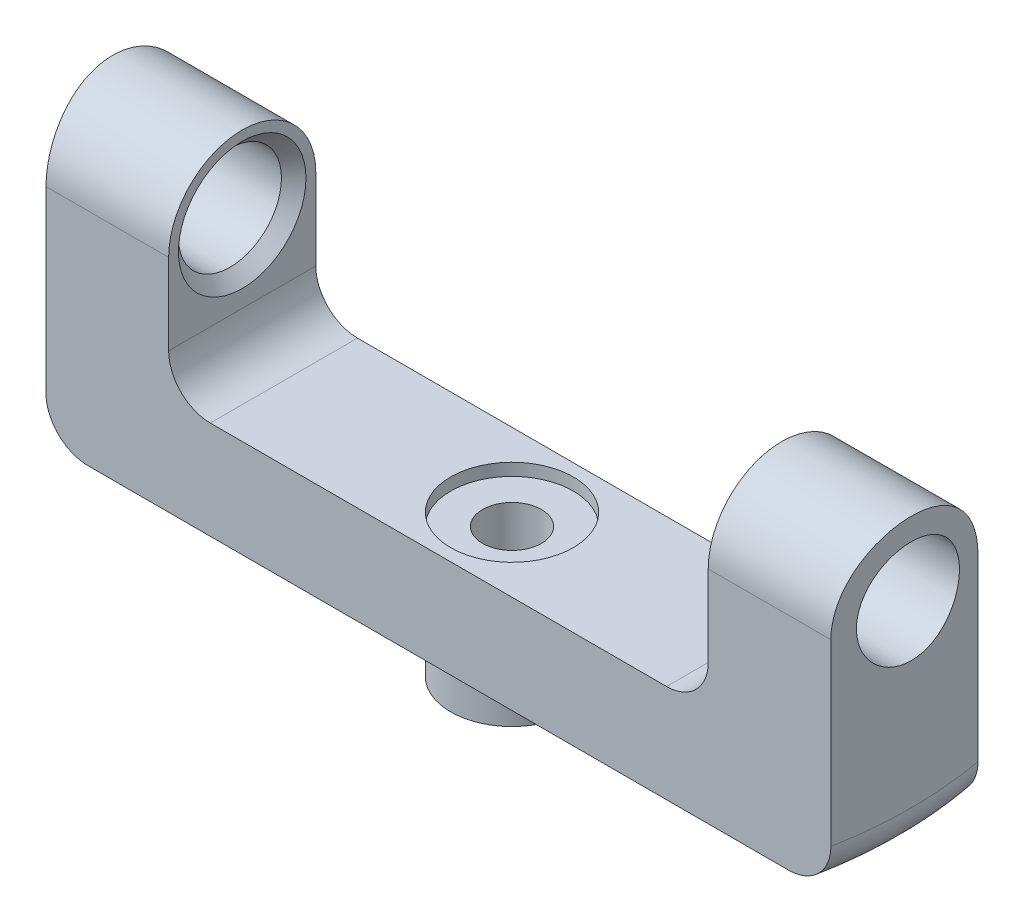
from build123d import *

# Parameters (mm, degrees)
SKETCH1_W               = 5
SKETCH1_H               = 6
SKETCH1_W_2             = 22
BOSS_EXTRUDE1_DEPTH     = 4
BOSS_EXTRUDE2_START     = 4
SKETCH1_3_W             = 5
SKETCH1_3_H             = 6
BOSS_EXTRUDE2_DEPTH     = 8
CUT_EXTRUDE1_DEPTH      = 30.952196132
CUT_EXTRUDE1_DEPTH_BACK = 30.952196132
SKETCH2_R               = 2.1
SKETCH4_R               = 2.5
BOSS_EXTRUDE3_DEPTH     = 1.8
CUT_EXTRUDE2_DEPTH      = 22.550870206
CUT_EXTRUDE2_DEPTH_BACK = 22.550870206
SKETCH5_R               = 1.2
SKETCH6_R               = 2.5
CUT_EXTRUDE3_DEPTH      = 0.5
CHAMFER1_SIZE           = 0.5
FILLET1_R               = 1.7


with BuildPart() as part:
    # Sketch1 → Boss-Extrude1 (new body)
    with BuildSketch(Plane(origin=(0, 0, 0), x_dir=(1, 0, 0), z_dir=(0, 1, 0))):
        with Locations((-13.5, 0)):
            Rectangle(SKETCH1_W, SKETCH1_H)
        Rectangle(SKETCH1_W_2, SKETCH1_H)
        with Locations((13.5, 0)):
            Rectangle(SKETCH1_W, SKETCH1_H)
        with BuildLine():
            Line((-16, -3), (-16, 3))
            ThreePointArc((-16, 3), (-16.278820596, 0), (-16, -3))
        make_face()
        with BuildLine():
            ThreePointArc((16.278820596, 0), (16.208965568, 1.506464481), (16, 3))
            Line((16, 3), (16, -3))
            ThreePointArc((16, -3), (16.208965568, -1.506464481), (16.278820596, 0))
        make_face()
    extrude(amount=BOSS_EXTRUDE1_DEPTH)

    # Sketch1<3> → Boss-Extrude2 (add)
    with BuildSketch(Plane(origin=(0, 0, 0), x_dir=(1, 0, 0), z_dir=(0, 1, 0)).offset(BOSS_EXTRUDE2_START)):
        with Locations((-13.5, 0)):
            Rectangle(SKETCH1_3_W, SKETCH1_3_H)
        with BuildLine():
            Line((-16, -3), (-16, 3))
            ThreePointArc((-16, 3), (-16.278820596, 0), (-16, -3))
        make_face()
        with Locations((13.5, 0)):
            Rectangle(SKETCH1_3_W, SKETCH1_3_H)
        with BuildLine():
            ThreePointArc((16.278820596, 0), (16.208965568, 1.506464481), (16, 3))
            Line((16, 3), (16, -3))
            ThreePointArc((16, -3), (16.208965568, -1.506464481), (16.278820596, 0))
        make_face()
    extrude(amount=BOSS_EXTRUDE2_DEPTH)

    # Sketch2 → Cut-Extrude1 (cut, two sides: drawn at the far end of the back side and taken through both)
    with BuildSketch(Plane(origin=(-11, 0, 0), x_dir=(0, 0, -1), z_dir=(1, 0, 0)).offset(-CUT_EXTRUDE1_DEPTH_BACK)):
        with BuildLine():
            Line((3, 12), (0, 12))
            ThreePointArc((0, 12), (2.121320344, 11.121320344), (3, 9))
            Line((3, 9), (3, 12))
        make_face()
        with BuildLine():
            Line((-3, 12), (-3, 9))
            ThreePointArc((-3, 9), (-2.121320344, 11.121320344), (0, 12))
            Line((0, 12), (-3, 12))
        make_face()
        with Locations((0, 9)):
            Circle(SKETCH2_R)
    extrude(amount=CUT_EXTRUDE1_DEPTH + CUT_EXTRUDE1_DEPTH_BACK, mode=Mode.SUBTRACT)

    # Sketch4 → Boss-Extrude3 (add)
    with BuildSketch(Plane.XZ):
        with Locations(Location((0, 0, 0), (0, 0, 270))):
            Circle(SKETCH4_R)
    extrude(amount=BOSS_EXTRUDE3_DEPTH)

    # Sketch5 → Cut-Extrude2 (cut, two sides: drawn at the far end of the back side and taken through both)
    with BuildSketch(Plane.XZ.offset(1.8).offset(-CUT_EXTRUDE2_DEPTH_BACK)):
        with Locations(Location((0, 0, 0), (0, 0, 270))):
            Circle(SKETCH5_R)
    extrude(amount=CUT_EXTRUDE2_DEPTH + CUT_EXTRUDE2_DEPTH_BACK, mode=Mode.SUBTRACT)

    # Sketch6 → Cut-Extrude3 (cut)
    with BuildSketch(Plane(origin=(0, 4, 0), x_dir=(1, 0, 0), z_dir=(0, 1, 0))):
        with Locations(Location((0, 0, 0), (0, 0, 90))):
            Circle(SKETCH6_R)
    extrude(amount=-CUT_EXTRUDE3_DEPTH, mode=Mode.SUBTRACT)

    # Chamfer1
    chamfer1_edges = [part.edges().sort_by_distance(p)[0] for p in [
        (11, 9, 2.1),
        (-11, 9, 2.1),
    ]]
    chamfer(chamfer1_edges, length=CHAMFER1_SIZE)

    # Fillet1
    fillet1_edges = [part.edges().sort_by_distance(p)[0] for p in [
        (-11, 4, 0),
        (11, 4, 0),
        (-16.278820596, 0, 0),
        (16.278820596, 0, 0),
    ]]
    fillet(fillet1_edges, radius=FILLET1_R)


solid = part.part
